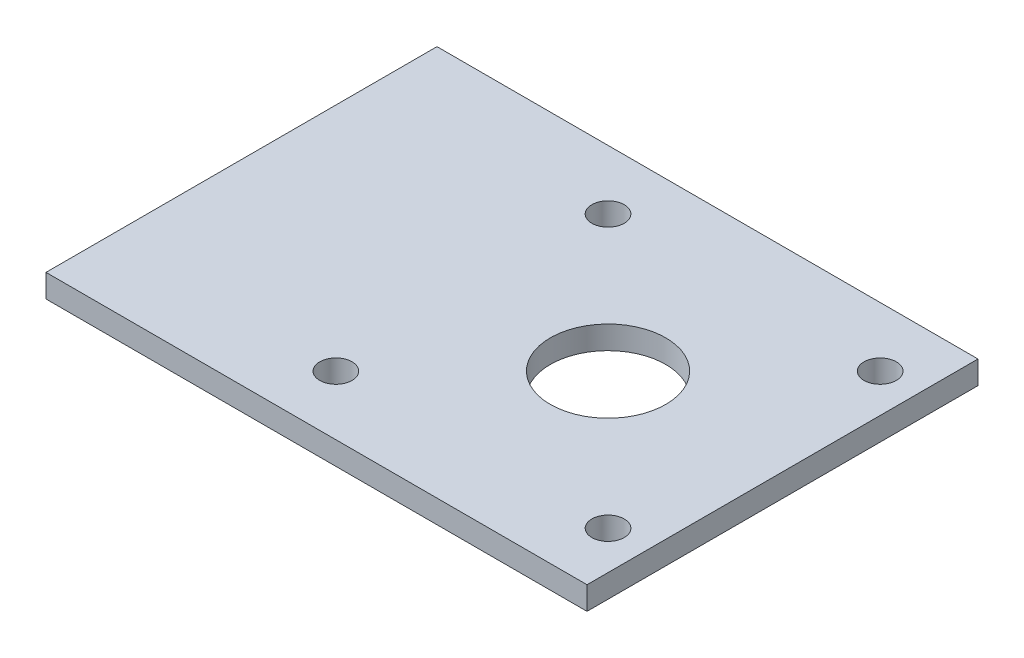
from build123d import *

# Parameters (mm, degrees)
SKETCH1_W               = 95.25
SKETCH1_H               = 50.8
BOSS_EXTRUDE1_DEPTH     = 3
CUT_EXTRUDE1_DEPTH      = 55.058307641
CUT_EXTRUDE1_DEPTH_BACK = 55.058307641
SKETCH2_R               = 2.1
CUT_EXTRUDE3_DEPTH      = 55.058307641
CUT_EXTRUDE3_DEPTH_BACK = 55.058307641
SKETCH4_R               = 7.5
CUT_EXTRUDE4_DEPTH      = 55.058307641
CUT_EXTRUDE4_DEPTH_BACK = 55.058307641
SKETCH5_W               = 24.95556865
SKETCH5_H               = 50.8


with BuildPart() as part:
    # Sketch1 → Boss-Extrude1 (new body)
    with BuildSketch(Plane(origin=(0, 0, 0), x_dir=(1, 0, 0), z_dir=(0, 1, 0))):
        Rectangle(SKETCH1_W, SKETCH1_H)
    extrude(amount=BOSS_EXTRUDE1_DEPTH)

    # Sketch2 → Cut-Extrude1 (cut, two sides: drawn at the far end of the back side and taken through both)
    with BuildSketch(Plane(origin=(0, 3, 0), x_dir=(1, 0, 0), z_dir=(0, 1, 0)).offset(-CUT_EXTRUDE1_DEPTH_BACK)):
        with Locations(Location((-17.68, 17.68, 0), (0, 0, 270))):
            Circle(SKETCH2_R)
        with Locations(Location((17.68, 17.68, 0), (0, 0, 270))):
            Circle(SKETCH2_R)
        with Locations(Location((17.68, -17.68, 0), (0, 0, 270))):
            Circle(SKETCH2_R)
        with Locations(Location((-17.68, -17.68, 0), (0, 0, 270))):
            Circle(SKETCH2_R)
    extrude(amount=CUT_EXTRUDE1_DEPTH + CUT_EXTRUDE1_DEPTH_BACK, mode=Mode.SUBTRACT)

    # Sketch4 → Cut-Extrude3 (cut, two sides: drawn at the far end of the back side and taken through both)
    with BuildSketch(Plane(origin=(0, 3, 0), x_dir=(1, 0, 0), z_dir=(0, 1, 0)).offset(-CUT_EXTRUDE3_DEPTH_BACK)):
        with Locations(Location((0, 0, 0), (0, 0, 270))):
            Circle(SKETCH4_R)
    extrude(amount=CUT_EXTRUDE3_DEPTH + CUT_EXTRUDE3_DEPTH_BACK, mode=Mode.SUBTRACT)

    # Sketch5 → Cut-Extrude4 (cut, two sides: drawn at the far end of the back side and taken through both)
    with BuildSketch(Plane(origin=(0, 3, 0), x_dir=(1, 0, 0), z_dir=(0, 1, 0)).offset(-CUT_EXTRUDE4_DEPTH_BACK)):
        with Locations((35.147215675, 0)):
            Rectangle(SKETCH5_W, SKETCH5_H)
    extrude(amount=CUT_EXTRUDE4_DEPTH + CUT_EXTRUDE4_DEPTH_BACK, mode=Mode.SUBTRACT)


solid = part.part
